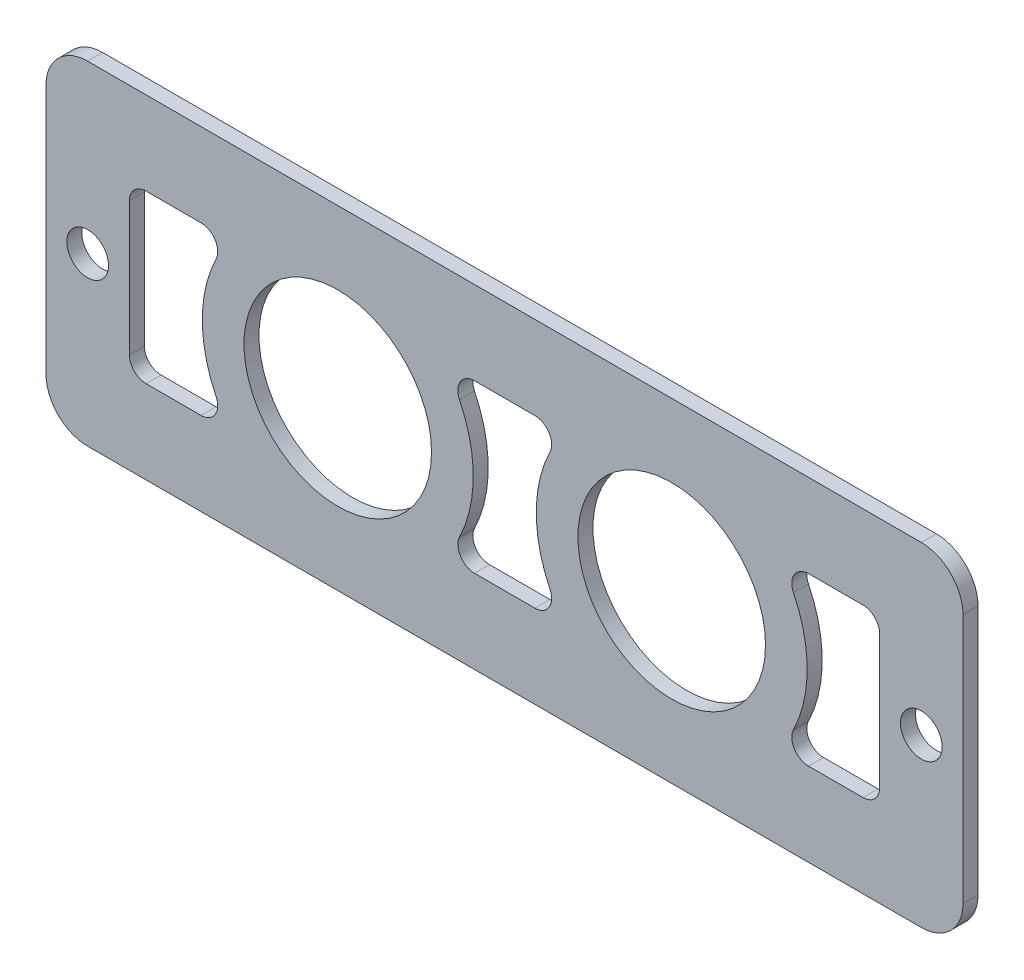
from build123d import *

# Parameters (mm, degrees)
SKETCH1_W           = 139.7
SKETCH1_H           = 50.8
SKETCH1_R           = 3.175
SKETCH1_R_2         = 14.2875
BOSS_EXTRUDE1_DEPTH = 1.143
FILLET1_R           = 6.35
CUT_EXTRUDE1_DEPTH  = 2.54
FILLET2_R           = 2.54


with BuildPart() as part:
    # Sketch1 → Boss-Extrude1 (new, symmetric)
    with BuildSketch(Plane.XY):
        Rectangle(SKETCH1_W, SKETCH1_H)
        with Locations((-63.5, 0)):
            Circle(SKETCH1_R, mode=Mode.SUBTRACT)
        with Locations((63.5, 0)):
            Circle(SKETCH1_R, mode=Mode.SUBTRACT)
        with Locations((-25.4, 0)):
            Circle(SKETCH1_R_2, mode=Mode.SUBTRACT)
        with Locations((25.4762, 0)):
            Circle(SKETCH1_R_2, mode=Mode.SUBTRACT)
    extrude(amount=BOSS_EXTRUDE1_DEPTH, both=True)

    # Fillet1
    fillet1_edges = [part.edges().sort_by_distance(p)[0] for p in [
        (69.85, -25.4, 0),
        (-69.85, -25.4, 0),
        (-69.85, 25.4, 0),
        (69.85, 25.4, 0),
    ]]
    fillet(fillet1_edges, radius=FILLET1_R)

    # Sketch2 → Cut-Extrude1 (cut)
    with BuildSketch(Plane.XY.offset(1.143)):
        with BuildLine():
            Line((-57.15, 12.7), (-57.15, -12.7))
            Line((-57.15, -12.7), (-41.667034341, -12.7))
            ThreePointArc((-41.667034341, -12.7), (-46.0375, 0), (-41.667034341, 12.7))
            Line((-41.667034341, 12.7), (-57.15, 12.7))
        make_face()
        with BuildLine():
            ThreePointArc((-4.7625, 0), (-5.885680547, -6.715485278), (-9.132965659, -12.7))
            Line((-9.132965659, -12.7), (9.209165659, -12.7))
            ThreePointArc((9.209165659, -12.7), (4.8387, 0), (9.209165659, 12.7))
            Line((9.209165659, 12.7), (-9.132965659, 12.7))
            ThreePointArc((-9.132965659, 12.7), (-5.885680547, 6.715485278), (-4.7625, 0))
        make_face()
        with BuildLine():
            ThreePointArc((46.1137, 0), (44.990519453, -6.715485278), (41.743234341, -12.7))
            Line((41.743234341, -12.7), (57.15, -12.7))
            Line((57.15, -12.7), (57.15, 12.7))
            Line((57.15, 12.7), (41.743234341, 12.7))
            ThreePointArc((41.743234341, 12.7), (44.990519453, 6.715485278), (46.1137, 0))
        make_face()
    extrude(amount=-CUT_EXTRUDE1_DEPTH, mode=Mode.SUBTRACT)

    # Fillet2
    fillet2_edges = [part.edges().sort_by_distance(p)[0] for p in [
        (-41.667034341, 12.7, 0),
        (-41.667034341, -12.7, 0),
        (-57.15, -12.7, 0),
        (-57.15, 12.7, 0),
        (9.209165659, 12.7, 0),
        (9.209165659, -12.7, 0),
        (-9.132965659, -12.7, 0),
        (-9.132965659, 12.7, 0),
        (41.743234341, -12.7, 0),
        (41.743234341, 12.7, 0),
        (57.15, 12.7, 0),
        (57.15, -12.7, 0),
    ]]
    fillet(fillet2_edges, radius=FILLET2_R)


solid = part.part
